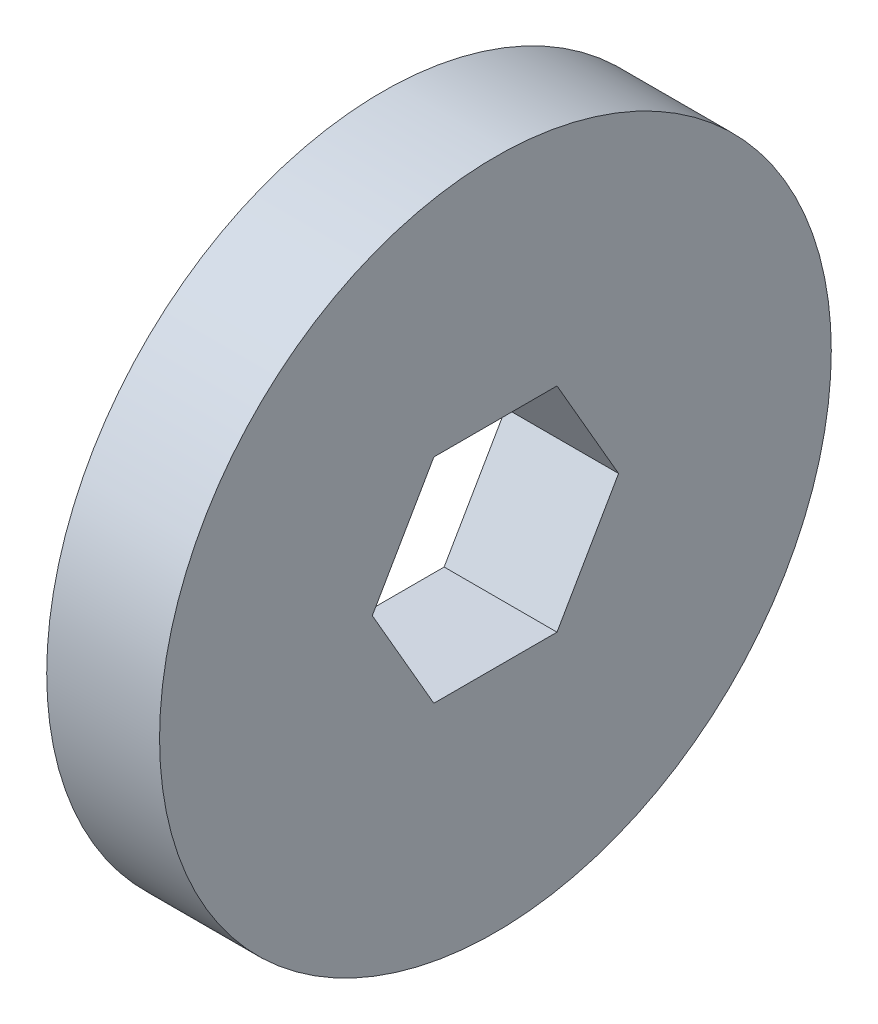
from build123d import *

# Parameters (mm, degrees)
CROQUIS1_R              = 20
SALIENTE_EXTRUIR1_DEPTH = 6.72


with BuildPart() as part:
    # Croquis1 → Saliente-Extruir1 (new body)
    with BuildSketch(Plane(origin=(0, 0, 0), x_dir=(0, 0, -1), z_dir=(1, 0, 0))):
        Circle(CROQUIS1_R)
        Polygon((7.332348419, 0), (3.666174209, 6.35), (-3.666174209, 6.35), (-7.332348419, 0), (-3.666174209, -6.35), (3.666174209, -6.35), align=None, mode=Mode.SUBTRACT)
    extrude(amount=SALIENTE_EXTRUIR1_DEPTH)


solid = part.part
